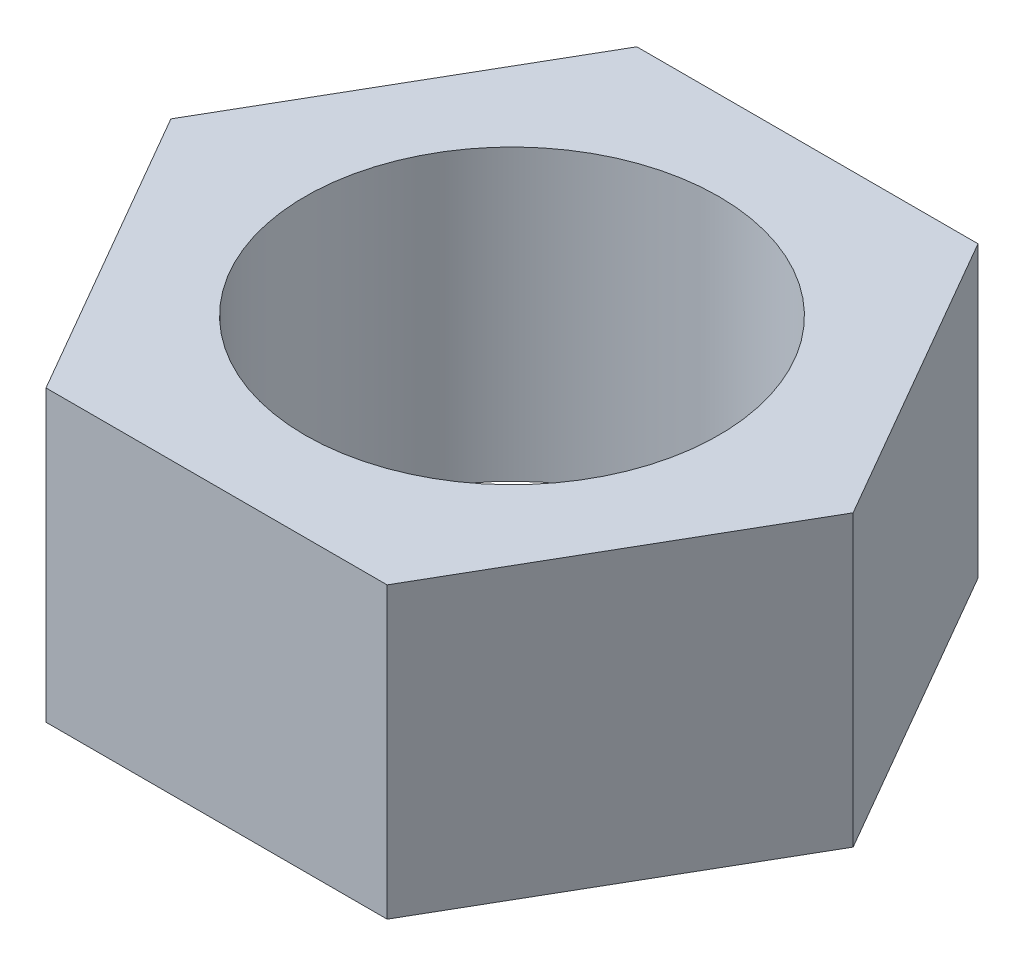
from build123d import *

# Parameters (mm, degrees)
BOSS_EXTRUDE1_DEPTH = 2.4892
SKETCH2_R           = 1.778
CUT_EXTRUDE1_DEPTH  = 5.609755956


with BuildPart() as part:
    # Sketch1 → Boss-Extrude1 (new body)
    with BuildSketch(Plane(origin=(0, 0, 0), x_dir=(1, 0, 0), z_dir=(0, 1, 0))):
        Polygon((1.466469684, 2.54), (-1.466469684, 2.54), (-2.932939367, 0), (-1.466469684, -2.54), (1.466469684, -2.54), (2.932939367, 0), align=None)
    extrude(amount=BOSS_EXTRUDE1_DEPTH)

    # Sketch2 → Cut-Extrude1 (cut, through all)
    with BuildSketch(Plane(origin=(0, 2.4892, 0), x_dir=(1, 0, 0), z_dir=(0, 1, 0))):
        with Locations(Location((0, 0, 0), (0, 0, 270))):
            Circle(SKETCH2_R)
    extrude(amount=-CUT_EXTRUDE1_DEPTH, mode=Mode.SUBTRACT)


solid = part.part
